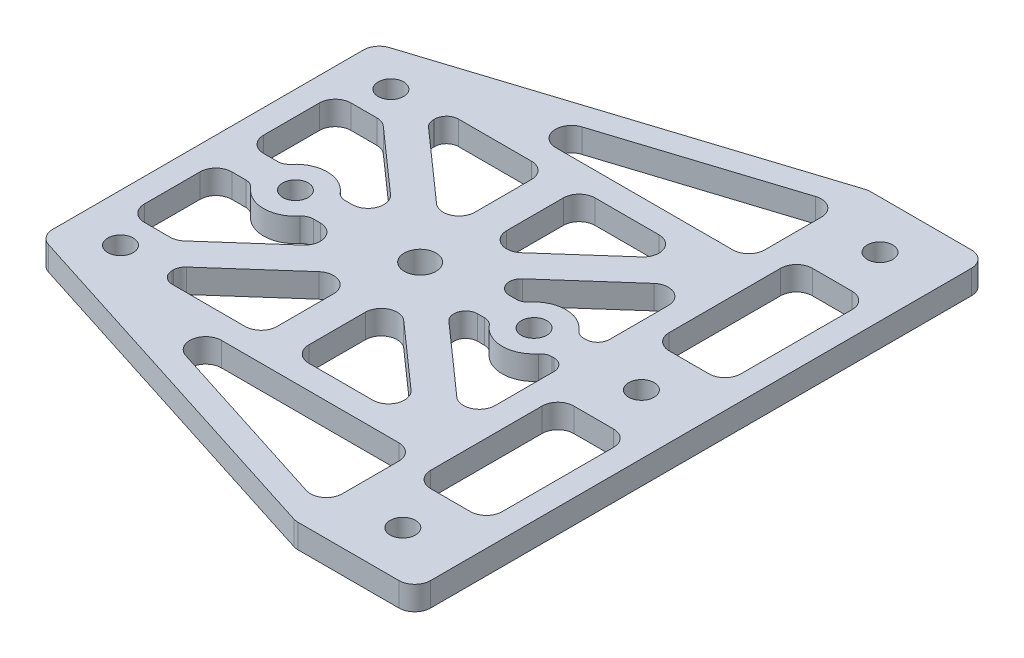
from build123d import *

# Parameters (mm, degrees)
SKETCH_1_R          = 1.6
EXTRUDE_1_DEPTH     = 3
SKETCH_2_W          = 38
SKETCH_2_H          = 42
CUT_EXTRUDE_1_DEPTH = 124.527324912
CUT_EXTRUDE_2_DEPTH = 90.235643103
SKETCH_4_W          = 9
SKETCH_4_H          = 18
SKETCH_4_W_2        = 15
SKETCH_4_H_2        = 9
CUT_EXTRUDE_3_DEPTH = 90.235643103
SKETCH_5_W          = 44
SKETCH_5_H          = 4
EXTRUDE_2_DEPTH     = 3
SKETCH_6_W          = 4
SKETCH_6_H          = 15.328304062
EXTRUDE_3_DEPTH     = 3
SKETCH_7_R          = 2
CUT_EXTRUDE_4_DEPTH = 86.0529247
EXTRUDE_4_DEPTH     = 3
FILLET_2_R          = 2
FILLET_1_R          = 1.5
SKETCH_9_R          = 1.6
CUT_EXTRUDE_5_DEPTH = 86.0529247
SKETCH_10_R         = 4
SKETCH_10_R_2       = 1.6
EXTRUDE_5_DEPTH     = 3
FILLET_3_R          = 1.5


with BuildPart() as part:
    # 草图1 → 凸台-拉伸1 (new body)
    with BuildSketch(Plane(origin=(0, 0, 0), x_dir=(1, 0, 0), z_dir=(0, 1, 0))):
        Polygon((-30, 39.804513537), (-30, 45), (-15, 45), (-15, -45), (-30, -45), (-30, -39.804513537), (-30, -21), (-96.599318778, -21), (-115, -21), (-115, 21), (-96.599318778, 21), (-30, 21), align=None)
        with Locations(Location((-71, -17, 0), (0, 0, 270))):
            Circle(SKETCH_1_R, mode=Mode.SUBTRACT)
        with Locations(Location((-71, 17, 0), (0, 0, 270))):
            Circle(SKETCH_1_R, mode=Mode.SUBTRACT)
        with Locations(Location((-22.5, 30, 0), (0, 0, 270))):
            Circle(SKETCH_1_R, mode=Mode.SUBTRACT)
        with Locations(Location((-22.5, -30, 0), (0, 0, 270))):
            Circle(SKETCH_1_R, mode=Mode.SUBTRACT)
        with Locations(Location((-22.5, 0, 0), (0, 0, 270))):
            Circle(SKETCH_1_R, mode=Mode.SUBTRACT)
    extrude(amount=EXTRUDE_1_DEPTH)

    # 草图2 → 切除-拉伸1 (cut, through all)
    with BuildSketch(Plane(origin=(0, 3, 0), x_dir=(1, 0, 0), z_dir=(0, 1, 0))):
        with Locations((-96, 0)):
            Rectangle(SKETCH_2_W, SKETCH_2_H)
    extrude(amount=-CUT_EXTRUDE_1_DEPTH, mode=Mode.SUBTRACT)

    # 草图3 → 切除-拉伸2 (cut, through all)
    with BuildSketch(Plane(origin=(0, 3, 0), x_dir=(1, 0, 0), z_dir=(0, 1, 0))):
        Polygon((-68.016430897, 13), (-74, 13), (-74, -13), (-68.016430897, -13), (-65, -10.328304062), (-65, 10.328304062), align=None)
        Polygon((-53.339011543, 0), (-65, 10.328304062), (-65, -10.328304062), align=None)
        Polygon((-65, 18), (-65, 15.671695938), (-50.322580645, 2.671695938), (-33.016430897, 18), align=None)
        Polygon((-30, 15.328304062), (-47.306149748, 0), (-30, -15.328304062), align=None)
        Polygon((-50.322580645, -2.671695938), (-65, -15.671695938), (-65, -18), (-33.016430897, -18), align=None)
    extrude(amount=-CUT_EXTRUDE_2_DEPTH, mode=Mode.SUBTRACT)

    # 草图4 → 切除-拉伸3 (cut, through all)
    with BuildSketch(Plane(origin=(0, 3, 0), x_dir=(1, 0, 0), z_dir=(0, 1, 0))):
        with Locations((-22.5, 15)):
            Rectangle(SKETCH_4_W, SKETCH_4_H)
        with Locations((-22.5, 40.5)):
            Rectangle(SKETCH_4_W_2, SKETCH_4_H_2)
        with Locations((-22.5, -40.5)):
            Rectangle(SKETCH_4_W_2, SKETCH_4_H_2)
        with Locations((-22.5, -15)):
            Rectangle(SKETCH_4_W, SKETCH_4_H)
    extrude(amount=-CUT_EXTRUDE_3_DEPTH, mode=Mode.SUBTRACT)

    # 草图5 → 凸台-拉伸2 (add)
    with BuildSketch(Plane(origin=(0, 3, 0), x_dir=(1, 0, 0), z_dir=(0, 1, 0))):
        with Locations((-52, 0)):
            Rectangle(SKETCH_5_W, SKETCH_5_H)
    extrude(amount=-EXTRUDE_2_DEPTH)

    # 草图6 → 凸台-拉伸3 (add)
    with BuildSketch(Plane(origin=(0, 3, 0), x_dir=(1, 0, 0), z_dir=(0, 1, 0))):
        with Locations((-50.322580645, -10.335847969)):
            Rectangle(SKETCH_6_W, SKETCH_6_H)
        with Locations((-50.322580645, 10.335847969)):
            Rectangle(SKETCH_6_W, SKETCH_6_H)
    extrude(amount=-EXTRUDE_3_DEPTH)

    # 草图7 → 切除-拉伸4 (cut, through all)
    with BuildSketch(Plane(origin=(0, 3, 0), x_dir=(1, 0, 0), z_dir=(0, 1, 0))):
        with Locations(Location((-50.322580645, 0, 0), (0, 0, 270))):
            Circle(SKETCH_7_R)
    extrude(amount=-CUT_EXTRUDE_4_DEPTH, mode=Mode.SUBTRACT)

    # 草图8 → 凸台-拉伸4 (add)
    with BuildSketch(Plane(origin=(0, 3, 0), x_dir=(1, 0, 0), z_dir=(0, 1, 0))):
        Polygon((-77, 21), (-30, 36), (-30, 32.850920072), (-67.132882893, 21), align=None)
        Polygon((-67.132882893, -21), (-77, -21), (-30, -36), (-30, -32.850920072), align=None)
    extrude(amount=-EXTRUDE_4_DEPTH)

    # 圆角2
    fillet_2_edges = [part.edges().sort_by_distance(p)[0] for p in [
        (-74, 1.5, -13),
        (-68.016430897, 1.5, -13),
        (-30, 1.5, -36),
        (-15, 1.5, -36),
        (-30, 1.5, 36),
        (-15, 1.5, 36),
        (-18, 1.5, 24),
        (-27, 1.5, 24),
        (-27, 1.5, 6),
        (-18, 1.5, 6),
        (-27, 1.5, -6),
        (-27, 1.5, -24),
        (-18, 1.5, -24),
        (-18, 1.5, -6),
        (-55.597076059, 1.5, -2),
        (-74, 1.5, -2),
        (-55.597076059, 1.5, 2),
        (-74, 1.5, 2),
        (-48.322580645, 1.5, -4.443124509),
        (-48.322580645, 1.5, 4.443124509),
        (-48.322580645, 1.5, 18),
        (-52.322580645, 1.5, 4.443124509),
        (-52.322580645, 1.5, 18),
        (-30, 1.5, 21),
        (-30, 1.5, -21),
        (-48.322580645, 1.5, -18),
        (-52.322580645, 1.5, -4.443124509),
        (-52.322580645, 1.5, -18),
        (-67.132882893, 1.5, -21),
        (-30, 1.5, -32.850920072),
        (-67.132882893, 1.5, 21),
        (-30, 1.5, 32.850920072),
        (-77, 1.5, -21),
        (-77, 1.5, 21),
        (-30, 1.5, -15.328304062),
        (-30, 1.5, 15.328304062),
        (-33.016430897, 1.5, -18),
        (-33.016430897, 1.5, 18),
        (-68.016430897, 1.5, 13),
        (-74, 1.5, 13),
    ]]
    fillet(fillet_2_edges, radius=FILLET_2_R)

    # 圆角1
    fillet_1_edges = [part.edges().sort_by_distance(p)[0] for p in [
        (-65, 1.5, -15.671695938),
        (-65, 1.5, -18),
        (-65, 1.5, 15.671695938),
        (-65, 1.5, 18),
    ]]
    fillet(fillet_1_edges, radius=FILLET_1_R)

    # 草图9 → 切除-拉伸5 (cut, through all)
    with BuildSketch(Plane(origin=(0, 3, 0), x_dir=(1, 0, 0), z_dir=(0, 1, 0))):
        with Locations(Location((-36, 0, 0), (0, 0, 270))):
            Circle(SKETCH_9_R)
        with Locations(Location((-66, 0, 0), (0, 0, 270))):
            Circle(SKETCH_9_R)
    extrude(amount=-CUT_EXTRUDE_5_DEPTH, mode=Mode.SUBTRACT)

    # 草图10 → 凸台-拉伸5 (add)
    # profile 1 of 2: a face of its own
    with BuildSketch(Plane(origin=(0, 3, 0), x_dir=(1, 0, 0), z_dir=(0, 1, 0))):
        with Locations((-66, 0)):
            Circle(SKETCH_10_R)
        with Locations(Location((-66, 0, 0), (0, 0, 270))):
            Circle(SKETCH_10_R_2, mode=Mode.SUBTRACT)
    # profile 2 of 2: a face of its own
    with BuildSketch(Plane(origin=(0, 3, 0), x_dir=(1, 0, 0), z_dir=(0, 1, 0))):
        with Locations((-36, 0)):
            Circle(SKETCH_10_R)
        with Locations(Location((-36, 0, 0), (0, 0, 270))):
            Circle(SKETCH_10_R_2, mode=Mode.SUBTRACT)
    extrude(amount=-EXTRUDE_5_DEPTH)

    # 圆角3
    fillet_3_edges = [part.edges().sort_by_distance(p)[0] for p in [
        (-45.048085232, 1.5, 2),
        (-30, 1.5, 2),
        (-30, 1.5, -2),
        (-45.048085232, 1.5, -2),
        (-69.464101615, 1.5, 2),
        (-62.535898385, 1.5, 2),
        (-32.535898385, 1.5, -2),
        (-39.464101615, 1.5, -2),
        (-69.464101615, 1.5, -2),
        (-62.535898385, 1.5, -2),
        (-32.535898385, 1.5, 2),
        (-39.464101615, 1.5, 2),
    ]]
    fillet(fillet_3_edges, radius=FILLET_3_R)


solid = part.part
